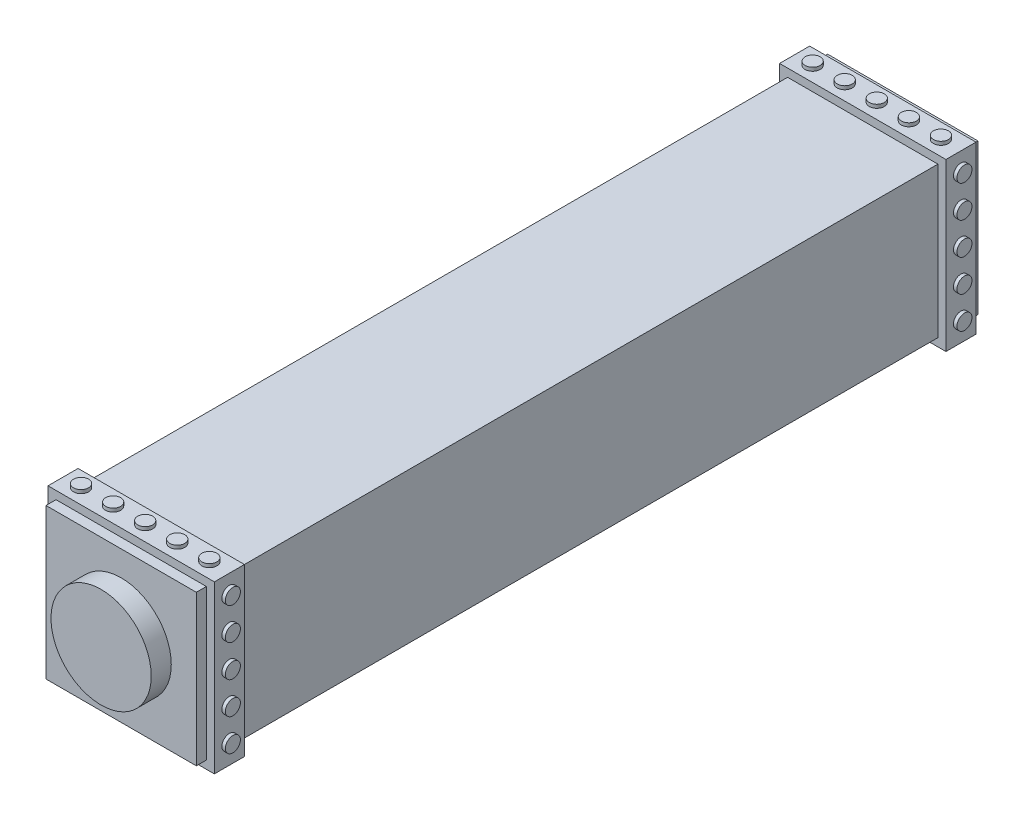
from build123d import *

# Parameters (mm, degrees)
SKETCH1_R               = 63.5
BOSS_EXTRUDE1_DEPTH     = 25.4
SKETCH2_W               = 190.5
SKETCH2_H               = 190.5
BOSS_EXTRUDE2_DEPTH     = 990.6
BOSS_EXTRUDE3_START     = 25.4
SKETCH3_R               = 63.5
BOSS_EXTRUDE3_DEPTH     = 25.4
SKETCH4_W               = 38.1
SKETCH4_H               = 200.66
BOSS_EXTRUDE4_DEPTH     = 10.16
SKETCH5_R               = 9.525
BOSS_EXTRUDE5_DEPTH     = 4.445
CIRPATTERN3_COUNT       = 4
MIRROR1_COPY_1_SKETCH_W = 38.1
MIRROR1_COPY_1_SKETCH_H = 200.66
MIRROR1_COPY_1_DEPTH    = 10.16
MIRROR1_COPY_2_SKETCH_W = 38.1
MIRROR1_COPY_2_SKETCH_H = 200.66
MIRROR1_COPY_2_DEPTH    = 10.16
MIRROR1_COPY_3_SKETCH_W = 38.1
MIRROR1_COPY_3_SKETCH_H = 200.66
MIRROR1_COPY_3_DEPTH    = 10.16
MIRROR1_COPY_4_SKETCH_R = 9.525
MIRROR1_COPY_4_DEPTH    = 4.445
MIRROR1_COPY_5_SKETCH_R = 9.525
MIRROR1_COPY_5_DEPTH    = 4.445
MIRROR1_COPY_6_SKETCH_R = 9.525
MIRROR1_COPY_6_DEPTH    = 4.445


with BuildPart() as part:
    # Sketch1 → Boss-Extrude1 (new body)
    with BuildSketch(Plane.XY):
        Circle(SKETCH1_R)
    extrude(amount=BOSS_EXTRUDE1_DEPTH)

    # Sketch2 → Boss-Extrude2 (add)
    with BuildSketch(Plane(origin=(0, 0, 0), x_dir=(-1, 0, 0), z_dir=(0, 0, -1))):
        Rectangle(SKETCH2_W, SKETCH2_H)
    extrude(amount=BOSS_EXTRUDE2_DEPTH)

    # Sketch3 → Boss-Extrude3 (add)
    with BuildSketch(Plane(origin=(0, 0, -990.6), x_dir=(-1, 0, 0), z_dir=(0, 0, -1)).offset(BOSS_EXTRUDE3_START)):
        with Locations(Location((0, 0, 0), (0, 0, 180))):
            Circle(SKETCH3_R)
    extrude(amount=-BOSS_EXTRUDE3_DEPTH)

    # Sketch4 → Boss-Extrude4 (add)
    with BuildSketch(Plane(origin=(95.25, 0, 0), x_dir=(0, 0, -1), z_dir=(1, 0, 0))):
        with Locations((31.75, 5.08)):
            Rectangle(SKETCH4_W, SKETCH4_H)
    boss_extrude4 = extrude(amount=BOSS_EXTRUDE4_DEPTH)

    # Sketch5 → Boss-Extrude5 (add)
    with BuildSketch(Plane(origin=(105.41, 0, 0), x_dir=(0, 0, -1), z_dir=(1, 0, 0))):
        with Locations(Location((31.75, 82.55, 0), (0, 0, 180))):
            Circle(SKETCH5_R)
        with Locations(Location((31.75, 41.91, 0), (0, 0, 180))):
            Circle(SKETCH5_R)
        with Locations(Location((31.75, 1.27, 0), (0, 0, 180))):
            Circle(SKETCH5_R)
        with Locations(Location((31.75, -39.37, 0), (0, 0, 180))):
            Circle(SKETCH5_R)
        with Locations(Location((31.75, -80.01, 0), (0, 0, 180))):
            Circle(SKETCH5_R)
    boss_extrude5 = extrude(amount=BOSS_EXTRUDE5_DEPTH)

    # CirPattern3: Boss-Extrude4, Boss-Extrude5 ×4 about axis
    cirpattern3_axis = Axis((0, 0, 0), (0, 0, 1))
    add([boss_extrude4.rotate(cirpattern3_axis, i * 360 / CIRPATTERN3_COUNT) for i in range(1, CIRPATTERN3_COUNT)])
    add([boss_extrude5.rotate(cirpattern3_axis, i * 360 / CIRPATTERN3_COUNT) for i in range(1, CIRPATTERN3_COUNT)])

    # Mirror1: Boss-Extrude4, Boss-Extrude5 across plane
    add(boss_extrude4.mirror(Plane.XY.offset(-495.3)))
    add(boss_extrude5.mirror(Plane.XY.offset(-495.3)))

    # Mirror1 copy 1 sketch → Mirror1 copy 1 (add)
    with BuildSketch(Plane(origin=(0, 95.25, -990.6), x_dir=(0, 0, 1), z_dir=(0, 1, 0))):
        with Locations((31.75, -5.08)):
            Rectangle(MIRROR1_COPY_1_SKETCH_W, MIRROR1_COPY_1_SKETCH_H)
    extrude(amount=MIRROR1_COPY_1_DEPTH)

    # Mirror1 copy 2 sketch → Mirror1 copy 2 (add)
    with BuildSketch(Plane(origin=(-95.25, 0, -990.6), x_dir=(0, 0, 1), z_dir=(-1, 0, 0))):
        with Locations((31.75, -5.08)):
            Rectangle(MIRROR1_COPY_2_SKETCH_W, MIRROR1_COPY_2_SKETCH_H)
    extrude(amount=MIRROR1_COPY_2_DEPTH)

    # Mirror1 copy 3 sketch → Mirror1 copy 3 (add)
    with BuildSketch(Plane(origin=(0, -95.25, -990.6), x_dir=(0, 0, 1), z_dir=(0, -1, 0))):
        with Locations((31.75, -5.08)):
            Rectangle(MIRROR1_COPY_3_SKETCH_W, MIRROR1_COPY_3_SKETCH_H)
    extrude(amount=MIRROR1_COPY_3_DEPTH)

    # Mirror1 copy 4 sketch → Mirror1 copy 4 (add)
    with BuildSketch(Plane(origin=(0, 105.41, -990.6), x_dir=(0, 0, 1), z_dir=(0, 1, 0))):
        with Locations((31.75, -82.55)):
            Circle(MIRROR1_COPY_4_SKETCH_R)
        with Locations((31.75, -41.91)):
            Circle(MIRROR1_COPY_4_SKETCH_R)
        with Locations((31.75, -1.27)):
            Circle(MIRROR1_COPY_4_SKETCH_R)
        with Locations((31.75, 39.37)):
            Circle(MIRROR1_COPY_4_SKETCH_R)
        with Locations((31.75, 80.01)):
            Circle(MIRROR1_COPY_4_SKETCH_R)
    extrude(amount=MIRROR1_COPY_4_DEPTH)

    # Mirror1 copy 5 sketch → Mirror1 copy 5 (add)
    with BuildSketch(Plane(origin=(-105.41, 0, -990.6), x_dir=(0, 0, 1), z_dir=(-1, 0, 0))):
        with Locations((31.75, -82.55)):
            Circle(MIRROR1_COPY_5_SKETCH_R)
        with Locations((31.75, -41.91)):
            Circle(MIRROR1_COPY_5_SKETCH_R)
        with Locations((31.75, -1.27)):
            Circle(MIRROR1_COPY_5_SKETCH_R)
        with Locations((31.75, 39.37)):
            Circle(MIRROR1_COPY_5_SKETCH_R)
        with Locations((31.75, 80.01)):
            Circle(MIRROR1_COPY_5_SKETCH_R)
    extrude(amount=MIRROR1_COPY_5_DEPTH)

    # Mirror1 copy 6 sketch → Mirror1 copy 6 (add)
    with BuildSketch(Plane(origin=(0, -105.41, -990.6), x_dir=(0, 0, 1), z_dir=(0, -1, 0))):
        with Locations((31.75, -82.55)):
            Circle(MIRROR1_COPY_6_SKETCH_R)
        with Locations((31.75, -41.91)):
            Circle(MIRROR1_COPY_6_SKETCH_R)
        with Locations((31.75, -1.27)):
            Circle(MIRROR1_COPY_6_SKETCH_R)
        with Locations((31.75, 39.37)):
            Circle(MIRROR1_COPY_6_SKETCH_R)
        with Locations((31.75, 80.01)):
            Circle(MIRROR1_COPY_6_SKETCH_R)
    extrude(amount=MIRROR1_COPY_6_DEPTH)


solid = part.part
